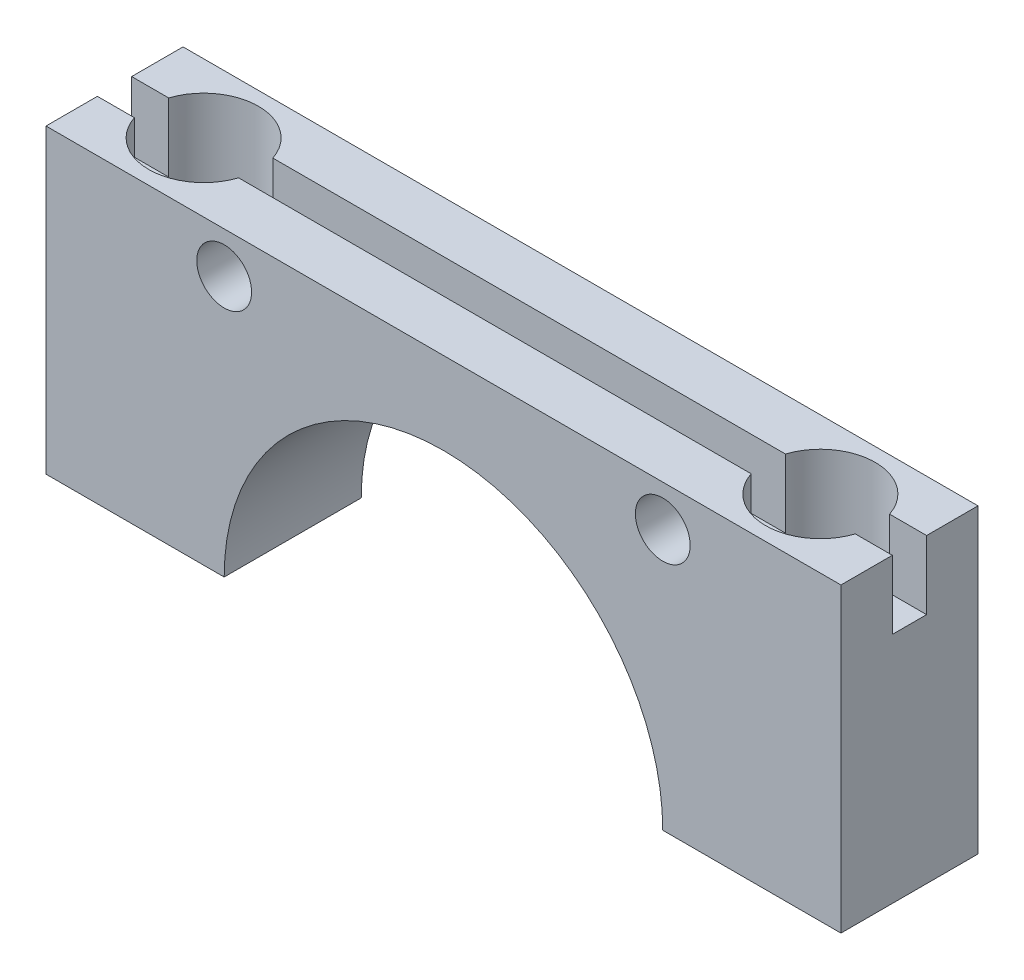
from build123d import *

# Parameters (mm, degrees)
EXTRUDE_1_DEPTH     = 10
SKETCH_2_R          = 1.8
SKETCH_2_R_2        = 1.88
CUT_EXTRUDE_1_DEPTH = 27
SKETCH_3_R          = 4
CUT_EXTRUDE_2_DEPTH = 15
SKETCH_4_W          = 58
SKETCH_4_H          = 2.5
CUT_EXTRUDE_4_DEPTH = 5
SKETCH_5_R          = 2
CUT_EXTRUDE_5_DEPTH = 5


with BuildPart() as part:
    # 草图1 → 凸台-拉伸1 (new body)
    with BuildSketch(Plane.XY):
        with BuildLine():
            Line((-69.33427814, 6.574466706), (-69.33427814, 28.574466706))
            Line((-69.33427814, 28.574466706), (-11.33427814, 28.574466706))
            Line((-11.33427814, 28.574466706), (-11.33427814, 6.574466706))
            Line((-11.33427814, 6.574466706), (-24.33427814, 6.574466706))
            ThreePointArc((-24.33427814, 6.574466706), (-40.33427814, 22.574466706), (-56.33427814, 6.574466706))
            Line((-56.33427814, 6.574466706), (-69.33427814, 6.574466706))
        make_face()
    extrude(amount=EXTRUDE_1_DEPTH)

    # 草图2 → 切除-拉伸1 (cut)
    with BuildSketch(Plane.XZ.offset(-6.574466706)):
        with Locations(Location((-62.83427814, 5, 0), (0, 0, 270))):
            Circle(SKETCH_2_R)
        with Locations(Location((-17.83427814, 5, 0), (0, 0, 270))):
            Circle(SKETCH_2_R_2)
    extrude(amount=-CUT_EXTRUDE_1_DEPTH, mode=Mode.SUBTRACT)

    # 草图3 → 切除-拉伸2 (cut)
    with BuildSketch(Plane(origin=(0, 28.574466706, 0), x_dir=(1, 0, 0), z_dir=(0, 1, 0))):
        with Locations(Location((-62.83427814, -5, 0), (0, 0, 270))):
            Circle(SKETCH_3_R)
        with Locations(Location((-17.83427814, -5, 0), (0, 0, 270))):
            Circle(SKETCH_3_R)
    extrude(amount=-CUT_EXTRUDE_2_DEPTH, mode=Mode.SUBTRACT)

    # 草图4 → 切除-拉伸4 (cut)
    with BuildSketch(Plane(origin=(0, 28.574466706, 0), x_dir=(1, 0, 0), z_dir=(0, 1, 0))):
        with Locations((-40.33427814, -5)):
            Rectangle(SKETCH_4_W, SKETCH_4_H)
    extrude(amount=-CUT_EXTRUDE_4_DEPTH, mode=Mode.SUBTRACT)

    # 草图5 → 切除-拉伸5 (cut)
    with BuildSketch(Plane.XY.offset(10)):
        with Locations((-56.33427814, 25.574466706)):
            Circle(SKETCH_5_R)
        with Locations((-24.33427814, 25.574466706)):
            Circle(SKETCH_5_R)
    extrude(amount=-CUT_EXTRUDE_5_DEPTH, mode=Mode.SUBTRACT)


solid = part.part
